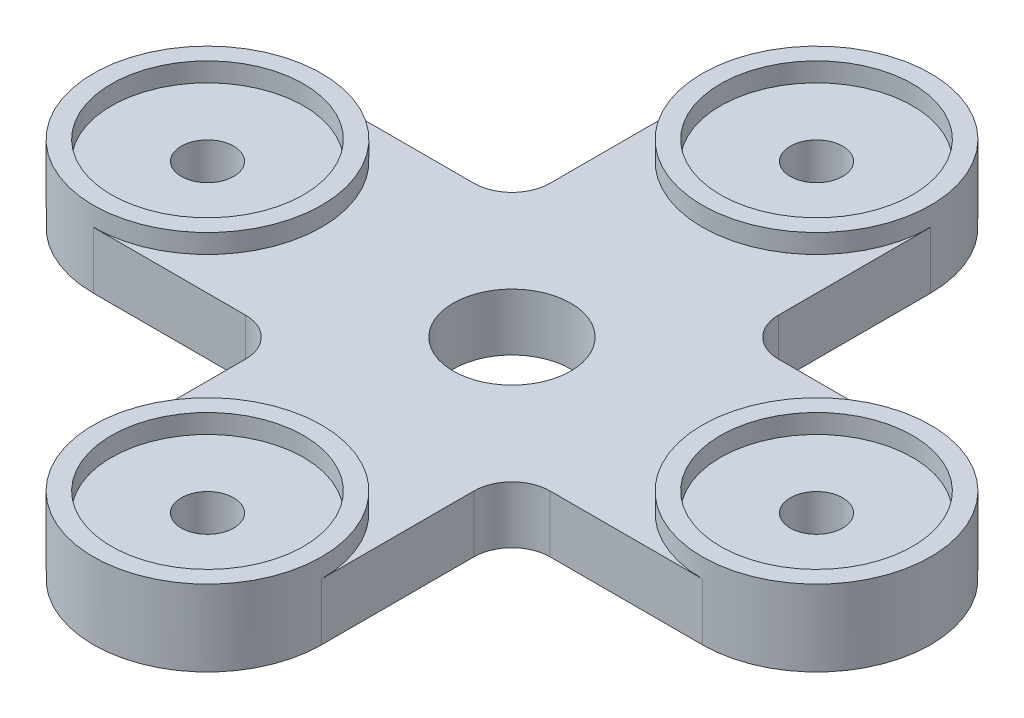
from build123d import *

# Parameters (mm, degrees)
SKETCH1_R                       = 3.925
BOSS_EXTRUDE1_DEPTH             = 3.81
SKETCH1_3_R                     = 6.4135
BOSS_EXTRUDE2_DEPTH             = 5.08
F_5_0_13779528_DIAMETER_HOLE1_D = 3.500000112
CIRPATTERN1_COUNT               = 4
FILLET1_R                       = 2.54


with BuildPart() as part:
    # Sketch1 → Boss-Extrude1 (new body)
    with BuildSketch(Plane(origin=(0, 0, 0), x_dir=(1, 0, 0), z_dir=(0, 1, 0))):
        with BuildLine():
            ThreePointArc((7.62, 20.32), (0, 27.94), (-7.62, 20.32))
            Line((-7.62, 20.32), (-7.62, 6.892838675))
            ThreePointArc((-7.62, 6.892838675), (0, -10.275), (7.62, 6.892838675))
            Line((7.62, 6.892838675), (7.62, 20.32))
        make_face()
        Circle(SKETCH1_R, mode=Mode.SUBTRACT)
    extrude(amount=BOSS_EXTRUDE1_DEPTH)

    # Sketch1<3> → Boss-Extrude2 (add)
    with BuildSketch(Plane(origin=(0, 0, 0), x_dir=(1, 0, 0), z_dir=(0, 1, 0))):
        with BuildLine():
            ThreePointArc((-7.62, 20.32), (0, 12.7), (7.62, 20.32))
            ThreePointArc((7.62, 20.32), (0, 27.94), (-7.62, 20.32))
        make_face()
        with Locations((0, 20.32)):
            Circle(SKETCH1_3_R, mode=Mode.SUBTRACT)
    extrude(amount=BOSS_EXTRUDE2_DEPTH)

    # #5 (0.13779528) Diameter Hole1 (through all)
    with Locations(Plane(origin=(0, 3.81, 0), x_dir=(1, 0, 0), z_dir=(0, 1, 0))):
        with Locations((0, 20.32)):
            Hole(F_5_0_13779528_DIAMETER_HOLE1_D / 2)

    # CirPattern1: part ×4 about axis
    cirpattern1_axis = Axis((0, 3.81, 0), (0, 1, 0))


with BuildPart() as part_1:
    add(part.part)
    for i in range(1, CIRPATTERN1_COUNT):
        add(part.part.rotate(cirpattern1_axis, i * 360 / CIRPATTERN1_COUNT))

    # Fillet1
    fillet1_edges = [part_1.edges().sort_by_distance(p)[0] for p in [
        (-7.62, 1.905, -7.62),
        (7.62, 1.905, -7.62),
        (-7.62, 1.905, 7.62),
        (7.62, 1.905, 7.62),
    ]]
    fillet(fillet1_edges, radius=FILLET1_R)


solid = part_1.part
